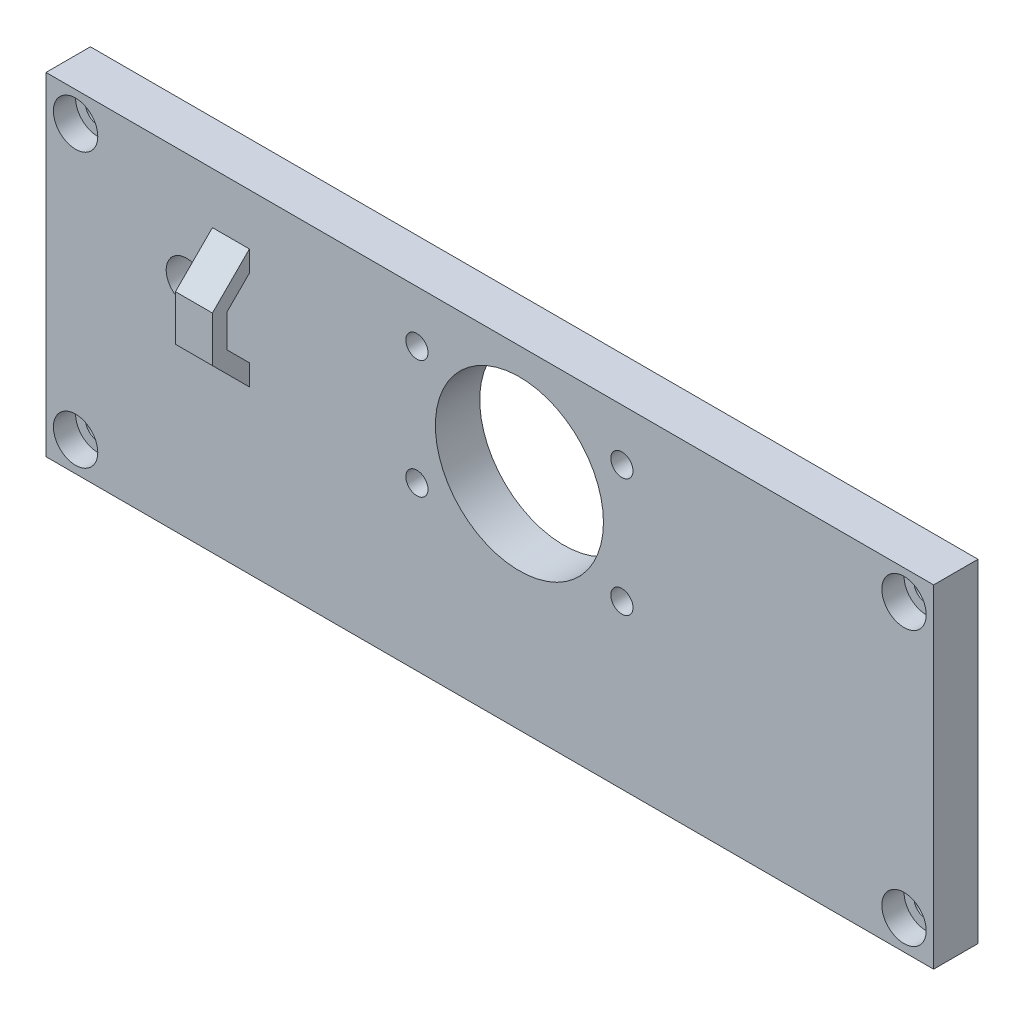
from build123d import *

# Parameters (mm, degrees)
SKETCH1_W           = 120
SKETCH1_H           = 45
SKETCH1_R           = 11.3625
SKETCH1_R_2         = 1.65
SKETCH1_R_3         = 1.5
BOSS_EXTRUDE1_DEPTH = 6
CUT_EXTRUDE1_START  = -3
SKETCH2_R           = 3
SKETCH2_R_2         = 1.65
CUT_EXTRUDE1_DEPTH  = 3
SKETCH3_R           = 2.75
CUT_EXTRUDE2_DEPTH  = 129.300428682
BOSS_EXTRUDE2_START = -22.5
BOSS_EXTRUDE2_DEPTH = 5


with BuildPart() as part:
    # Sketch1 → Boss-Extrude1 (new body)
    with BuildSketch(Plane.XY):
        with Locations((60, 22.5)):
            Rectangle(SKETCH1_W, SKETCH1_H)
        with Locations((64, 30)):
            Circle(SKETCH1_R, mode=Mode.SUBTRACT)
        with Locations((4, 41)):
            Circle(SKETCH1_R_2, mode=Mode.SUBTRACT)
        with Locations(Location((4, 4, 0), (0, 0, 180))):
            Circle(SKETCH1_R_2, mode=Mode.SUBTRACT)
        with Locations(Location((116, 41, 0), (0, 0, 180))):
            Circle(SKETCH1_R_2, mode=Mode.SUBTRACT)
        with Locations((116, 4)):
            Circle(SKETCH1_R_2, mode=Mode.SUBTRACT)
        with Locations((50.143593539, 38)):
            Circle(SKETCH1_R_3, mode=Mode.SUBTRACT)
        with Locations(Location((50.143593539, 22, 0), (0, 0, 180))):
            Circle(SKETCH1_R_3, mode=Mode.SUBTRACT)
        with Locations((77.856406461, 22)):
            Circle(SKETCH1_R_3, mode=Mode.SUBTRACT)
        with Locations(Location((77.856406461, 38, 0), (0, 0, 180))):
            Circle(SKETCH1_R_3, mode=Mode.SUBTRACT)
    extrude(amount=BOSS_EXTRUDE1_DEPTH)

    # Sketch2 → Cut-Extrude1 (cut)
    # profile 1 of 4: a face of its own
    with BuildSketch(Plane.XY.offset(6).offset(CUT_EXTRUDE1_START)):
        with Locations((4, 41)):
            Circle(SKETCH2_R)
        with Locations((4, 41)):
            Circle(SKETCH2_R_2, mode=Mode.SUBTRACT)
    # profile 2 of 4: a face of its own
    with BuildSketch(Plane.XY.offset(6).offset(CUT_EXTRUDE1_START)):
        with Locations((4, 4)):
            Circle(SKETCH2_R)
        with Locations(Location((4, 4, 0), (0, 0, 180))):
            Circle(SKETCH2_R_2, mode=Mode.SUBTRACT)
    # profile 3 of 4: a face of its own
    with BuildSketch(Plane.XY.offset(6).offset(CUT_EXTRUDE1_START)):
        with Locations((116, 4)):
            Circle(SKETCH2_R)
        with Locations((116, 4)):
            Circle(SKETCH2_R_2, mode=Mode.SUBTRACT)
    # profile 4 of 4: a face of its own
    with BuildSketch(Plane.XY.offset(6).offset(CUT_EXTRUDE1_START)):
        with Locations((116, 41)):
            Circle(SKETCH2_R)
        with Locations(Location((116, 41, 0), (0, 0, 180))):
            Circle(SKETCH2_R_2, mode=Mode.SUBTRACT)
    extrude(amount=CUT_EXTRUDE1_DEPTH, mode=Mode.SUBTRACT)

    # Sketch3 → Cut-Extrude2 (cut, through all)
    with BuildSketch(Plane.XY.offset(6)):
        with Locations((19, 30)):
            Circle(SKETCH3_R)
    extrude(amount=-CUT_EXTRUDE2_DEPTH, mode=Mode.SUBTRACT)

    # Sketch4 → Boss-Extrude2 (add)
    with BuildSketch(Plane.ZY.offset(BOSS_EXTRUDE2_START)):
        Polygon((6, 35.25), (9, 32.25), (9, 27.75), (6, 24.75), (6, 21.921572875), (7.414213562, 23.335786438), (11, 26.921572875), (11, 33.078427125), (7.414213562, 36.664213562), (6, 38.078427125), align=None)
    extrude(amount=-BOSS_EXTRUDE2_DEPTH)


solid = part.part
